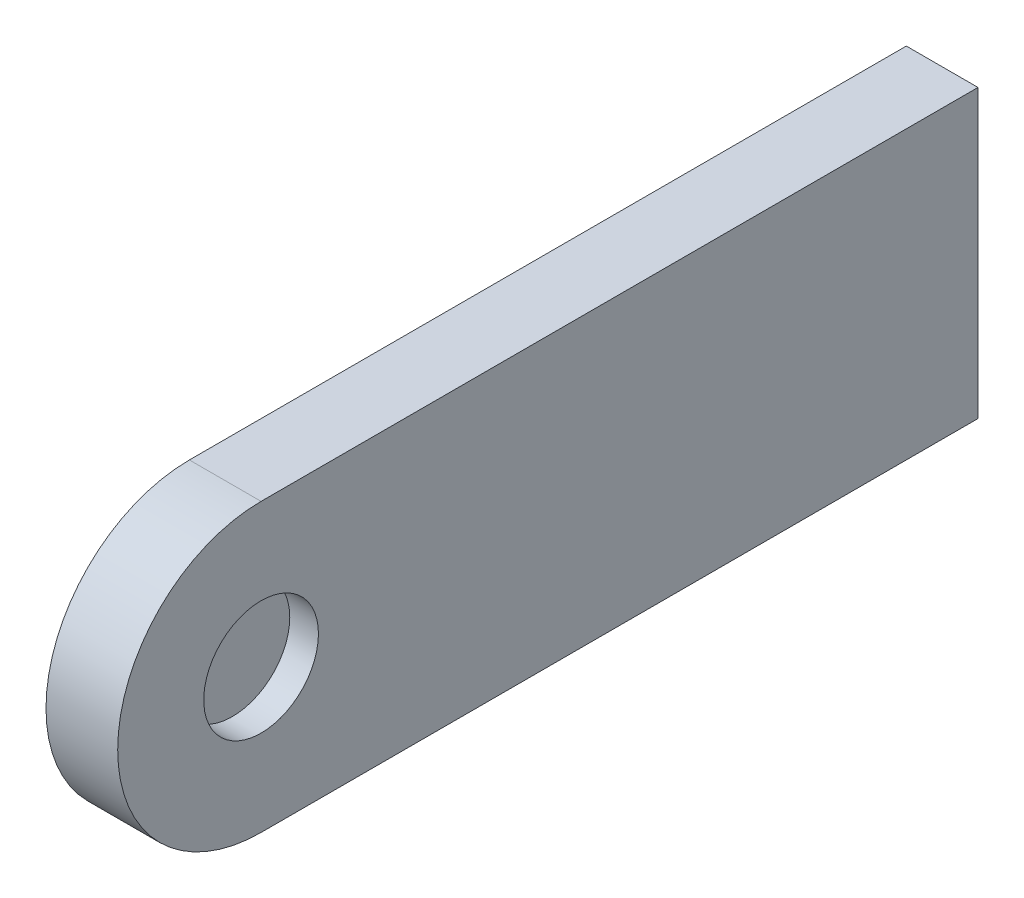
from build123d import *

# Parameters (mm, degrees)
BOSS_EXTRUDE1_DEPTH = 5
CUT_EXTRUDE3_DEPTH  = 2


with BuildPart() as part:
    # Sketch1 → Boss-Extrude1 (new body)
    with BuildSketch(Plane(origin=(0, 0, 0), x_dir=(0, 0, -1), z_dir=(1, 0, 0))):
        with BuildLine():
            Line((-25, 10), (25, 10))
            Line((25, 10), (25, -10))
            Line((25, -10), (-25, -10))
            ThreePointArc((-25, -10), (-35, 0), (-25, 10))
        make_face()
    extrude(amount=BOSS_EXTRUDE1_DEPTH)

    # Sketch2 → Cut-Extrude3 (cut)
    with BuildSketch(Plane(origin=(5, 0, 0), x_dir=(0, 0, -1), z_dir=(1, 0, 0))):
        with BuildLine():
            ThreePointArc((-21, 0), (-22.171572875, 2.828427125), (-25, 4))
            Line((-25, 4), (-25, -4))
            ThreePointArc((-25, -4), (-22.171572875, -2.828427125), (-21, 0))
        make_face()
        with BuildLine():
            Line((-25, -4), (-25, 4))
            ThreePointArc((-25, 4), (-29, 0), (-25, -4))
        make_face()
    extrude(amount=-CUT_EXTRUDE3_DEPTH, mode=Mode.SUBTRACT)


solid = part.part
